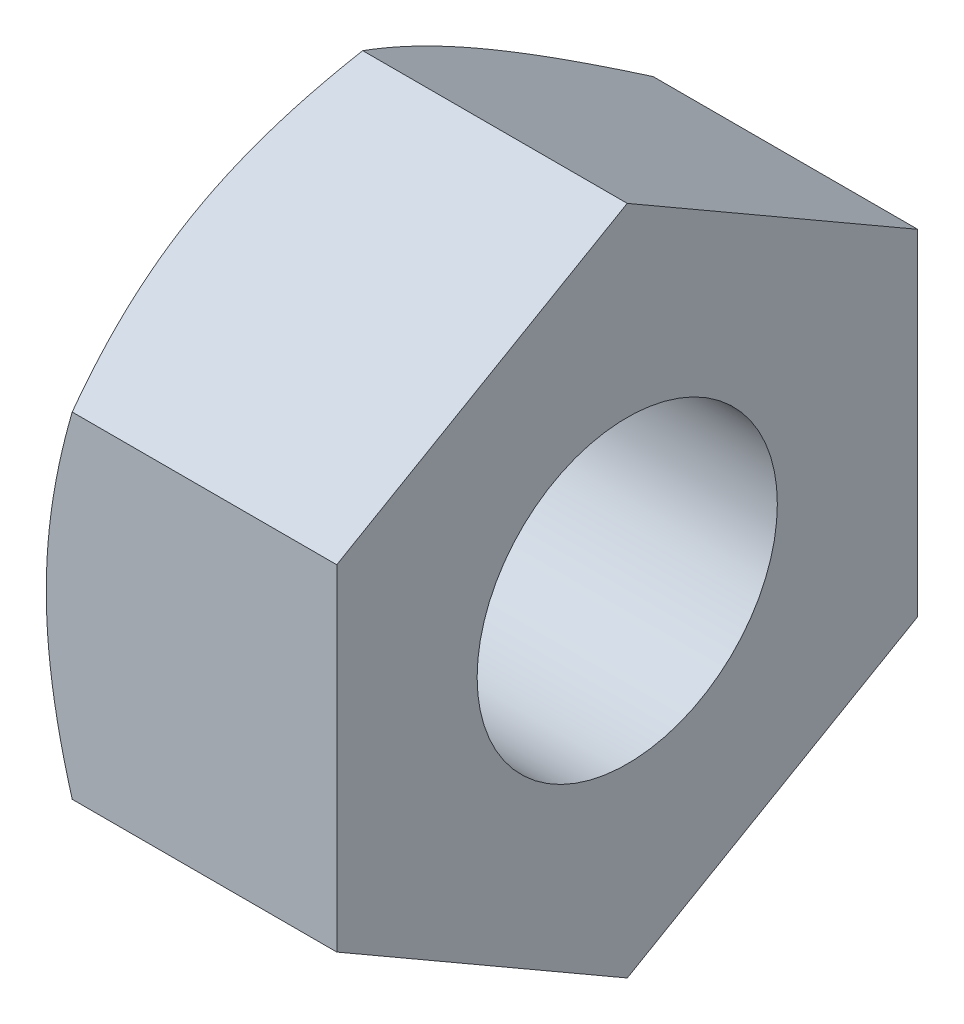
from build123d import *

# Parameters (mm, degrees)
BOSS_EXTRUDE1_DEPTH = 4
TAP1_D              = 4.134


with BuildPart() as part:
    # Sketch1 → Boss-Extrude1 (new body)
    with BuildSketch(Plane(origin=(0, 0, 0), x_dir=(0, 0, -1), z_dir=(1, 0, 0))):
        Polygon((0, 4.618802154), (-4, 2.309401077), (-4, -2.309401077), (0, -4.618802154), (4, -2.309401077), (4, 2.309401077), align=None)
    extrude(amount=-BOSS_EXTRUDE1_DEPTH)

    # Sketch2 → Cut-Revolve1 (revolve, cut)
    with BuildSketch(Plane.XY):
        Polygon((-4, 4), (-3.64273441, 4.618802154), (-4, 4.618802154), align=None)
    revolve(axis=Axis((-2.23854625, 0, 0), (1, 0, 0)), mode=Mode.SUBTRACT)

    # Tap1 (through all)
    with Locations(Plane.ZY.offset(4)):
        with Locations((0, 0)):
            Hole(TAP1_D / 2)


solid = part.part
